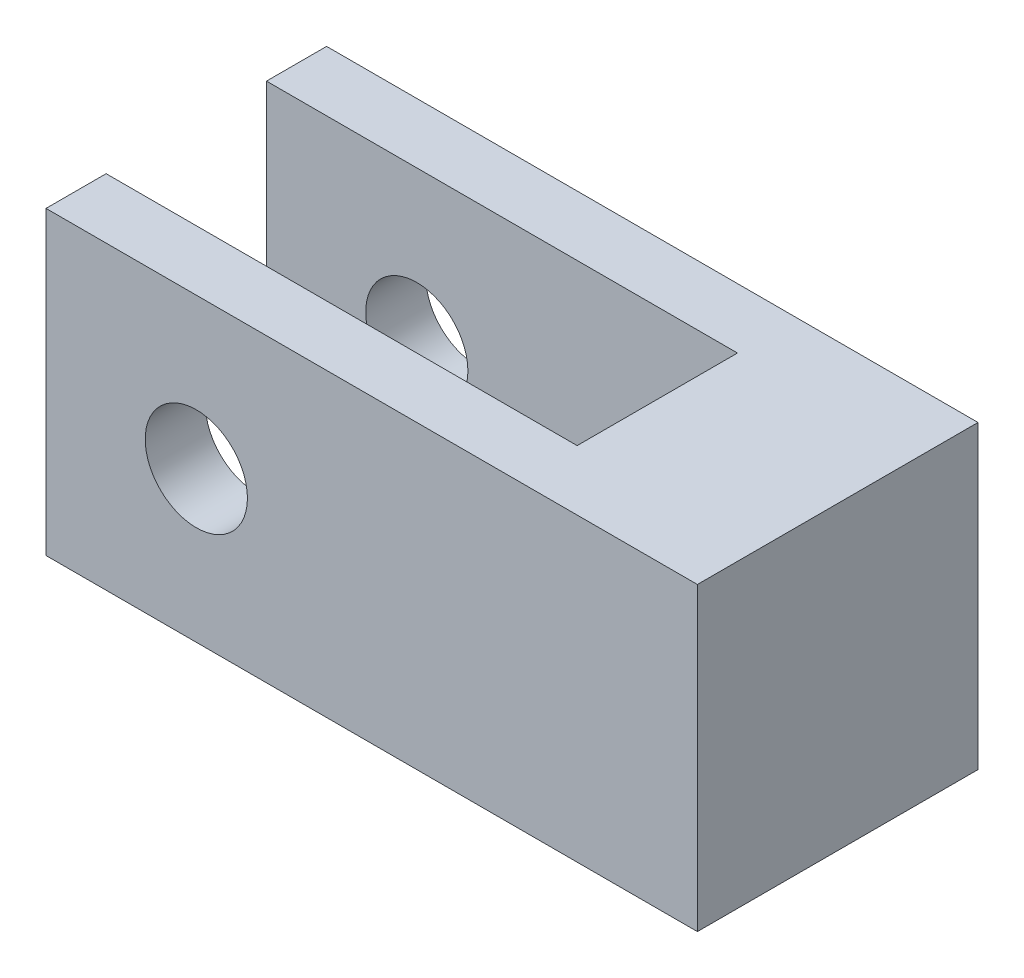
from build123d import *

# Parameters (mm, degrees)
SKETCH1_W               = 65
SKETCH1_H               = 30
BOSS_EXTRUDE1_DEPTH     = 14
SKETCH2_W               = 48
SKETCH2_H               = 32
CUT_EXTRUDE1_DEPTH      = 8
CUT_EXTRUDE2_DEPTH      = 55.046276467
CUT_EXTRUDE2_DEPTH_BACK = 55.046276467
SKETCH3_R               = 5.1


with BuildPart() as part:
    # Sketch1 → Boss-Extrude1 (new, symmetric)
    with BuildSketch(Plane.XY):
        with Locations((17.5, 0)):
            Rectangle(SKETCH1_W, SKETCH1_H)
    extrude(amount=BOSS_EXTRUDE1_DEPTH, both=True)

    # Sketch2 → Cut-Extrude1 (cut, symmetric)
    with BuildSketch(Plane.XY):
        with Locations((8, 0)):
            Rectangle(SKETCH2_W, SKETCH2_H)
    extrude(amount=CUT_EXTRUDE1_DEPTH, both=True, mode=Mode.SUBTRACT)

    # Sketch3 → Cut-Extrude2 (cut, two sides: drawn at the far end of the back side and taken through both)
    with BuildSketch(Plane.XY.offset(-CUT_EXTRUDE2_DEPTH_BACK)):
        Circle(SKETCH3_R)
    extrude(amount=CUT_EXTRUDE2_DEPTH + CUT_EXTRUDE2_DEPTH_BACK, mode=Mode.SUBTRACT)


solid = part.part
